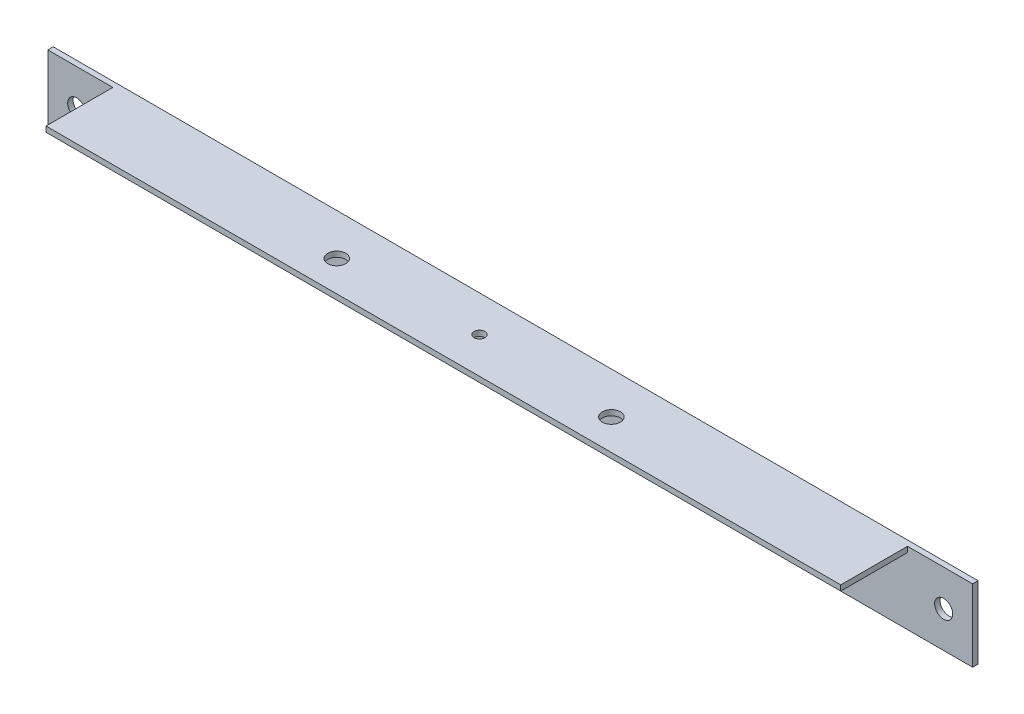
from build123d import *

# Parameters (mm, degrees)
EXTRU_MINCE1_DEPTH      = 128
ESQUISSE2_R             = 2.5
ENL_V_MAT_EXTRU_1_DEPTH = 10
ESQUISSE3_R             = 2.5
ESQUISSE3_W             = 18
ESQUISSE3_H             = 18.5
ENL_V_MAT_EXTRU_2_DEPTH = 10
ESQUISSE4_R             = 1.5
ENL_V_MAT_EXTRU_3_DEPTH = 5
ESQUISSE5_R             = 1.5
ENL_V_MAT_EXTRU_4_DEPTH = 5


with BuildPart() as part:
    # Esquisse1 → Extru.-Mince1 (new, symmetric)
    with BuildSketch(Plane(origin=(0, 0, 0), x_dir=(0, 0, -1), z_dir=(1, 0, 0))):
        Polygon((-20, 0), (0, 0), (0, -20), (-1.5, -20), (-1.5, -1.5), (-20, -1.5), align=None)
    extrude(amount=EXTRU_MINCE1_DEPTH, both=True)

    # Esquisse2 → Enlèv. mat.-Extru.1 (cut)
    with BuildSketch(Plane.XY.offset(1.5)):
        with Locations((-120, -10)):
            Circle(ESQUISSE2_R)
        with Locations(Location((120, -10, 0), (0, 0, 90))):
            Circle(ESQUISSE2_R)
    extrude(amount=-ENL_V_MAT_EXTRU_1_DEPTH, mode=Mode.SUBTRACT)

    # Esquisse3 → Enlèv. mat.-Extru.2 (cut)
    with BuildSketch(Plane.XZ.offset(1.5)):
        with Locations(Location((-38, 11.5, 0), (0, 0, 270))):
            Circle(ESQUISSE3_R)
        with Locations(Location((38, 11.5, 0), (0, 0, 90))):
            Circle(ESQUISSE3_R)
        with Locations((-119, 10.75)):
            Rectangle(ESQUISSE3_W, ESQUISSE3_H)
        with Locations((119, 10.75)):
            Rectangle(ESQUISSE3_W, ESQUISSE3_H)
    extrude(amount=-ENL_V_MAT_EXTRU_2_DEPTH, mode=Mode.SUBTRACT)

    # Esquisse4 → Enlèv. mat.-Extru.3 (cut)
    with BuildSketch(Plane(origin=(0, 0, 0), x_dir=(1, 0, 0), z_dir=(0, 1, 0))):
        with Locations(Location((0, -10, 0), (0, 0, 270))):
            Circle(ESQUISSE4_R)
    extrude(amount=-ENL_V_MAT_EXTRU_3_DEPTH, mode=Mode.SUBTRACT)

    # Esquisse5 → Enlèv. mat.-Extru.4 (cut)
    with BuildSketch(Plane(origin=(0, 0, 0), x_dir=(-1, 0, 0), z_dir=(0, 0, -1))):
        with Locations(Location((-20, -10, 0), (0, 0, 90))):
            Circle(ESQUISSE5_R)
        with Locations(Location((20, -10, 0), (0, 0, 90))):
            Circle(ESQUISSE5_R)
    extrude(amount=-ENL_V_MAT_EXTRU_4_DEPTH, mode=Mode.SUBTRACT)


solid = part.part
